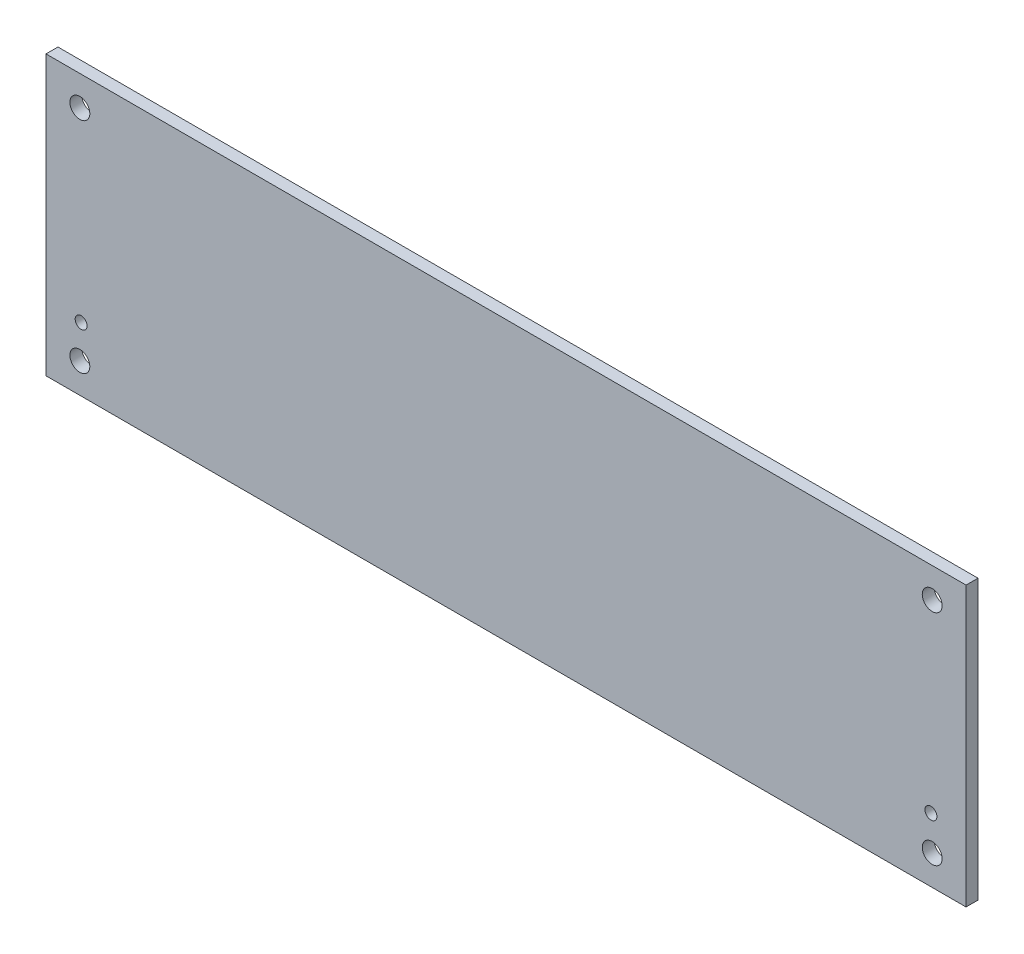
from build123d import *

# Parameters (mm, degrees)
SKETCH_1_W          = 231
SKETCH_1_H          = 70
SKETCH_1_R          = 2.5
EXTRUDE_1_DEPTH     = 3
SKETCH_4_R          = 1.5
CUT_EXTRUDE_1_DEPTH = 10


with BuildPart() as part:
    # 草图1 → 凸台-拉伸1 (new body)
    with BuildSketch(Plane.XY):
        Rectangle(SKETCH_1_W, SKETCH_1_H)
        with Locations((-107, 27.5)):
            Circle(SKETCH_1_R, mode=Mode.SUBTRACT)
        with Locations(Location((-107, -27.5, 0), (0, 0, 180))):
            Circle(SKETCH_1_R, mode=Mode.SUBTRACT)
        with Locations((107, -27.5)):
            Circle(SKETCH_1_R, mode=Mode.SUBTRACT)
        with Locations(Location((107, 27.5, 0), (0, 0, 180))):
            Circle(SKETCH_1_R, mode=Mode.SUBTRACT)
    extrude(amount=EXTRUDE_1_DEPTH)

    # 草图4 → 切除-拉伸1 (cut)
    with BuildSketch(Plane.XY.offset(3)):
        with Locations((-106.677486576, -19)):
            Circle(SKETCH_4_R)
    cut_extrude_1 = extrude(amount=-CUT_EXTRUDE_1_DEPTH, mode=Mode.SUBTRACT)

    # 镜向1: 切除-拉伸1 across plane
    add(cut_extrude_1.mirror(Plane(origin=(0, 0, 0), x_dir=(0, 0, 1), z_dir=(1, 0, 0))), mode=Mode.SUBTRACT)


solid = part.part
